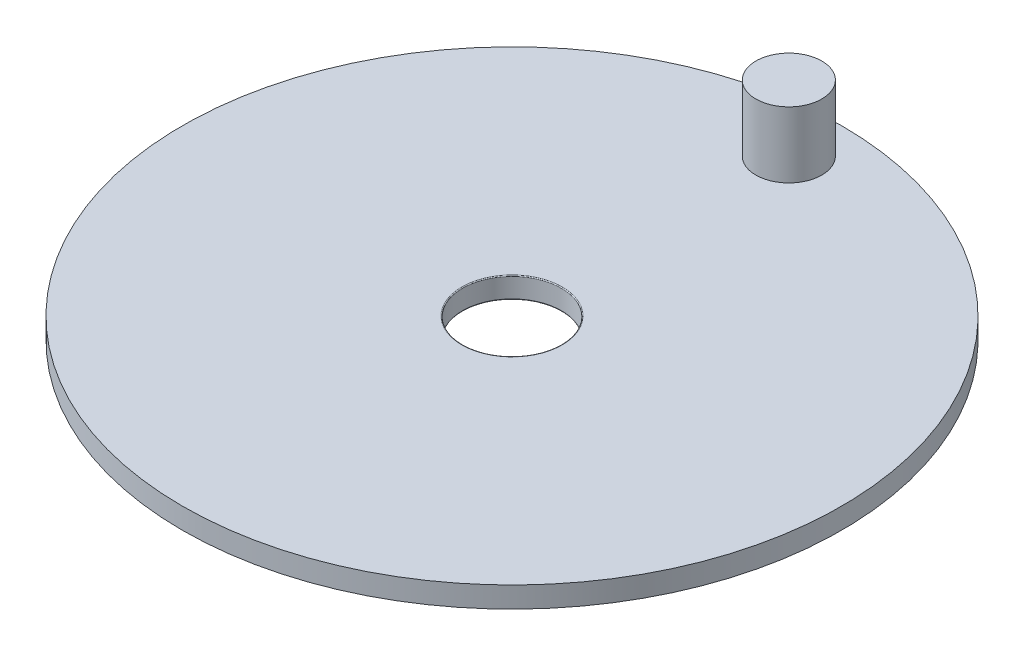
from build123d import *

# Parameters (mm, degrees)
SKETCH1_R           = 50
BOSS_EXTRUDE1_DEPTH = 3.175
SKETCH3_R           = 7.5
CUT_EXTRUDE1_DEPTH  = 71.78192301
FILLET3_R           = 0.127
SKETCH4_R           = 5
BOSS_EXTRUDE2_DEPTH = 10


with BuildPart() as part:
    # Sketch1 → Boss-Extrude1 (new body)
    with BuildSketch(Plane(origin=(0, 0, 0), x_dir=(1, 0, 0), z_dir=(0, 1, 0))):
        Circle(SKETCH1_R)
    extrude(amount=BOSS_EXTRUDE1_DEPTH)

    # Sketch3 → Cut-Extrude1 (cut, through all)
    with BuildSketch(Plane(origin=(0, 3.175, 0), x_dir=(1, 0, 0), z_dir=(0, 1, 0))):
        Circle(SKETCH3_R)
    extrude(amount=-CUT_EXTRUDE1_DEPTH, mode=Mode.SUBTRACT)

    # Fillet3
    fillet3_edges = [part.edges().sort_by_distance(p)[0] for p in [
        (-7.5, 0, 0),
        (-7.5, 3.175, 0),
    ]]
    fillet(fillet3_edges, radius=FILLET3_R)

    # Sketch4 → Boss-Extrude2 (add)
    with BuildSketch(Plane(origin=(0, 3.175, 0), x_dir=(1, 0, 0), z_dir=(0, 1, 0))):
        with Locations((0, 42)):
            Circle(SKETCH4_R)
    extrude(amount=BOSS_EXTRUDE2_DEPTH)


solid = part.part
